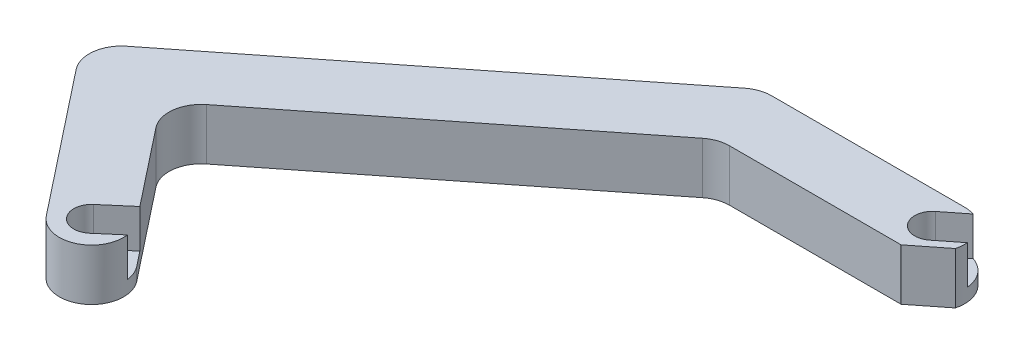
from build123d import *

# Parameters (mm, degrees)
SKETCH1_R           = 2.75
BOSS_EXTRUDE1_DEPTH = 8
CUT_EXTRUDE1_DEPTH  = 6
CUT_EXTRUDE2_DEPTH  = 30.169438933
BOSS_EXTRUDE2_START = -8
SKETCH4_R           = 2.75
BOSS_EXTRUDE2_DEPTH = 8
CUT_EXTRUDE3_DEPTH  = 6
FILLET1_R           = 5


with BuildPart() as part:
    # Sketch1 → Boss-Extrude1 (new body)
    with BuildSketch(Plane(origin=(0, 0, 0), x_dir=(1, 0, 0), z_dir=(0, 1, 0))):
        with BuildLine():
            Line((-7.712527276, 6.5), (22.287472724, 6.5))
            ThreePointArc((22.287472724, 6.5), (27.287472724, 1.5), (22.287472724, -3.5))
            Line((22.287472724, -3.5), (-7.712527276, -3.5))
            ThreePointArc((-7.712527276, -3.5), (-12.712527276, 1.5), (-7.712527276, 6.5))
        make_face()
        with Locations(Location((22.287472724, 1.5, 0), (0, 0, 270))):
            Circle(SKETCH1_R, mode=Mode.SUBTRACT)
    extrude(amount=BOSS_EXTRUDE1_DEPTH)

    # Sketch2 → Cut-Extrude1 (cut)
    with BuildSketch(Plane(origin=(0, 8, 0), x_dir=(1, 0, 0), z_dir=(0, 1, 0))):
        Polygon((20.58345093, 3.658427605), (23.991494517, -0.658427605), (33.922344634, 7.181717223), (30.514301047, 11.498572433), align=None)
    extrude(amount=-CUT_EXTRUDE1_DEPTH, mode=Mode.SUBTRACT)

    # Sketch3 → Cut-Extrude2 (cut, through all)
    with BuildSketch(Plane(origin=(0, 8, 0), x_dir=(1, 0, 0), z_dir=(0, 1, 0))):
        Polygon((19.607061, -5.712417018), (21.868852578, -8.577353017), (34.080402114, 1.063343984), (31.818610536, 3.928279983), align=None)
    extrude(amount=-CUT_EXTRUDE2_DEPTH, mode=Mode.SUBTRACT)

    # Sketch4 → Boss-Extrude2 (add)
    with BuildSketch(Plane(origin=(0, 8, 0), x_dir=(1, 0, 0), z_dir=(0, 1, 0)).offset(BOSS_EXTRUDE2_START)):
        with BuildLine():
            Line((-4.614305833, -2.424413828), (-54.336629031, -41.678879507))
            Line((-54.336629031, -41.678879507), (-40.041435295, -59.786124909))
            ThreePointArc((-40.041435295, -59.786124909), (-40.86762768, -66.808760179), (-47.89026295, -65.982567794))
            Line((-47.89026295, -65.982567794), (-65.28367813, -43.950908565))
            ThreePointArc((-65.28367813, -43.950908565), (-66.325017324, -40.268480884), (-64.457485745, -36.928273294))
            Line((-64.457485745, -36.928273294), (-10.810748719, 5.424413828))
            ThreePointArc((-10.810748719, 5.424413828), (-3.788113448, 4.598221443), (-4.614305833, -2.424413828))
        make_face()
        with Locations(Location((-43.965849122, -62.884346351, 0), (0, 0, 270))):
            Circle(SKETCH4_R, mode=Mode.SUBTRACT)
    extrude(amount=BOSS_EXTRUDE2_DEPTH)

    # Sketch5 → Cut-Extrude3 (cut)
    with BuildSketch(Plane(origin=(0, 8, 0), x_dir=(1, 0, 0), z_dir=(0, 1, 0))):
        Polygon((-45.754712001, -60.795693771), (-42.176986244, -64.972998932), (-32.718063171, -56.871739527), (-36.295788929, -52.694434367), align=None)
    extrude(amount=-CUT_EXTRUDE3_DEPTH, mode=Mode.SUBTRACT)

    # Fillet1
    fillet1_edges = [part.edges().sort_by_distance(p)[0] for p in [
        (-5.976714985, 4, 3.5),
        (-54.336629031, 4, 41.678879507),
    ]]
    fillet(fillet1_edges, radius=FILLET1_R)


solid = part.part
